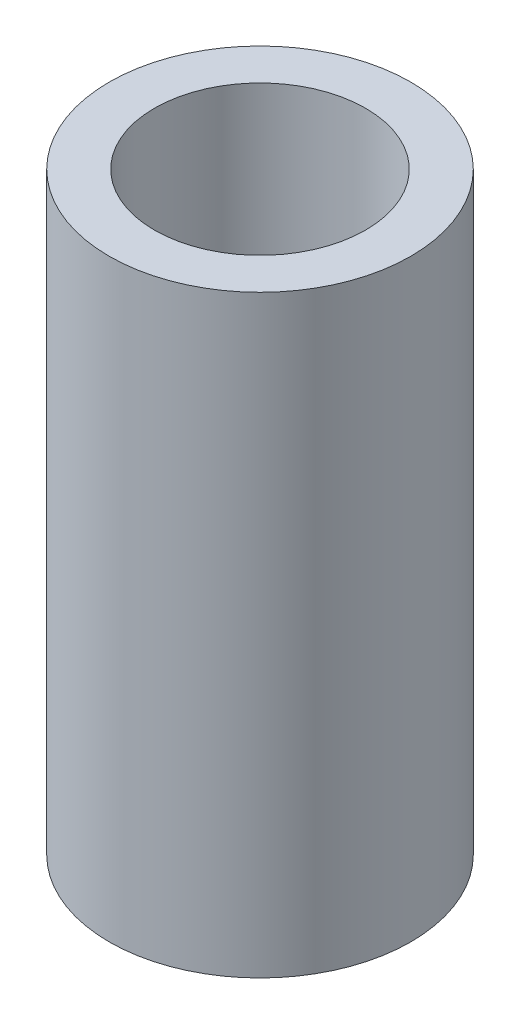
from build123d import *

# Parameters (mm, degrees)
SKETCH2_R           = 2.54
BOSS_EXTRUDE1_DEPTH = 10
SKETCH3_R           = 1.778
CUT_EXTRUDE1_DEPTH  = 10


with BuildPart() as part:
    # Sketch2 → Boss-Extrude1 (new body)
    with BuildSketch(Plane(origin=(0, 0, 0), x_dir=(1, 0, 0), z_dir=(0, 1, 0))):
        with Locations(Location((0, 0, 0), (0, 0, 270))):
            Circle(SKETCH2_R)
    extrude(amount=BOSS_EXTRUDE1_DEPTH)

    # Sketch3 → Cut-Extrude1 (cut)
    with BuildSketch(Plane(origin=(0, 10, 0), x_dir=(1, 0, 0), z_dir=(0, 1, 0))):
        with Locations(Location((0, 0, 0), (0, 0, 270))):
            Circle(SKETCH3_R)
    extrude(amount=-CUT_EXTRUDE1_DEPTH, mode=Mode.SUBTRACT)


solid = part.part
